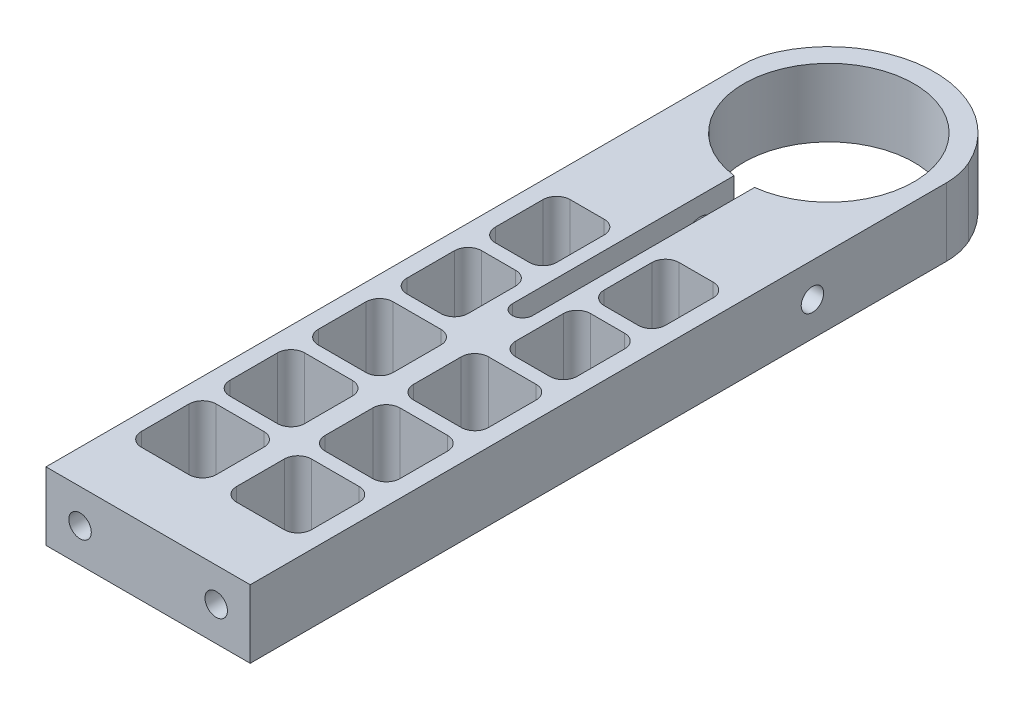
from build123d import *

# Parameters (mm, degrees)
SKETCH_1_R                  = 12.5
EXTRUDE_1_DEPTH             = 10
CUT_EXTRUDE_5_DEPTH         = 102.687019821
SKETCH_8_W                  = 1.65
SKETCH_8_H                  = 14
HOLE_WIZARD_M41_D           = 4.5
HOLE_WIZARD_M41_DEPTH       = 14
HOLE_WIZARD_M41_CBORE_D     = 8
HOLE_WIZARD_M41_CBORE_DEPTH = 4.5
CUT_EXTRUDE_START           = -10
CUT_EXTRUDE_6_DEPTH         = 10
FILLET_1_R                  = 10
M4X0_72_D                   = 3.3
M4X0_72_DEPTH               = 10
M4X0_72_TIP                 = 0.991420021
CUT_EXTRUDE_7_DEPTH         = 102.612007273
EXTRUDE_2_DEPTH             = 10


with BuildPart() as part:
    # Эскиз1 → Бобышка-Вытянуть1 (new body)
    with BuildSketch(Plane(origin=(0, 0, 0), x_dir=(1, 0, 0), z_dir=(0, 1, 0))):
        with BuildLine():
            Line((-15.5, 0), (-15.5, -100))
            Line((-15.5, -100), (15.5, -100))
            Line((15.5, -100), (15.5, 0))
            ThreePointArc((15.5, 0), (0, 15.5), (-15.5, 0))
        make_face()
        with Locations(Location((0, 0, 0), (0, 0, 270))):
            Circle(SKETCH_1_R, mode=Mode.SUBTRACT)
    extrude(amount=EXTRUDE_1_DEPTH)

    # Эскиз6 → Вырез-Вытянуть5 (cut, through all)
    with BuildSketch(Plane(origin=(0, 10, 0), x_dir=(1, 0, 0), z_dir=(0, 1, 0))):
        with BuildLine():
            Line((-1.5, -12.409673646), (-1.5, -26))
            ThreePointArc((-1.5, -26), (0, -27.5), (1.5, -26))
            Line((1.5, -26), (1.5, -12.409673646))
            ThreePointArc((1.5, -12.409673646), (0, -12.5), (-1.5, -12.409673646))
        make_face()
        with BuildLine():
            Line((-1.5, -42.5), (-1.5, -49.5))
            ThreePointArc((-1.5, -49.5), (-2.085786438, -50.914213562), (-3.5, -51.5))
            Line((-3.5, -51.5), (-10.5, -51.5))
            ThreePointArc((-10.5, -51.5), (-11.914213562, -50.914213562), (-12.5, -49.5))
            Line((-12.5, -49.5), (-12.5, -42.5))
            ThreePointArc((-12.5, -42.5), (-11.914213562, -41.085786438), (-10.5, -40.5))
            Line((-10.5, -40.5), (-3.5, -40.5))
            ThreePointArc((-3.5, -40.5), (-2.085786438, -41.085786438), (-1.5, -42.5))
        make_face()
        with BuildLine():
            Line((-1.5, -55.5), (-1.5, -62.5))
            ThreePointArc((-1.5, -62.5), (-2.085786438, -63.914213562), (-3.5, -64.5))
            Line((-3.5, -64.5), (-10.5, -64.5))
            ThreePointArc((-10.5, -64.5), (-11.914213562, -63.914213562), (-12.5, -62.5))
            Line((-12.5, -62.5), (-12.5, -55.5))
            ThreePointArc((-12.5, -55.5), (-11.914213562, -54.085786438), (-10.5, -53.5))
            Line((-10.5, -53.5), (-3.5, -53.5))
            ThreePointArc((-3.5, -53.5), (-2.085786438, -54.085786438), (-1.5, -55.5))
        make_face()
        with BuildLine():
            Line((-1.5, -68.5), (-1.5, -75.5))
            ThreePointArc((-1.5, -75.5), (-2.085786438, -76.914213562), (-3.5, -77.5))
            Line((-3.5, -77.5), (-10.5, -77.5))
            ThreePointArc((-10.5, -77.5), (-11.914213562, -76.914213562), (-12.5, -75.5))
            Line((-12.5, -75.5), (-12.5, -68.5))
            ThreePointArc((-12.5, -68.5), (-11.914213562, -67.085786438), (-10.5, -66.5))
            Line((-10.5, -66.5), (-3.5, -66.5))
            ThreePointArc((-3.5, -66.5), (-2.085786438, -67.085786438), (-1.5, -68.5))
        make_face()
        with BuildLine():
            Line((-1.5, -81.5), (-1.5, -88.5))
            ThreePointArc((-1.5, -88.5), (-2.085786438, -89.914213562), (-3.5, -90.5))
            Line((-3.5, -90.5), (-10.5, -90.5))
            ThreePointArc((-10.5, -90.5), (-11.914213562, -89.914213562), (-12.5, -88.5))
            Line((-12.5, -88.5), (-12.5, -81.5))
            ThreePointArc((-12.5, -81.5), (-11.914213562, -80.085786438), (-10.5, -79.5))
            Line((-10.5, -79.5), (-3.5, -79.5))
            ThreePointArc((-3.5, -79.5), (-2.085786438, -80.085786438), (-1.5, -81.5))
        make_face()
        with BuildLine():
            Line((1.5, -29.5), (1.5, -36.5))
            ThreePointArc((1.5, -36.5), (2.085786438, -37.914213562), (3.5, -38.5))
            Line((3.5, -38.5), (10.5, -38.5))
            ThreePointArc((10.5, -38.5), (11.914213562, -37.914213562), (12.5, -36.5))
            Line((12.5, -36.5), (12.5, -29.5))
            ThreePointArc((12.5, -29.5), (11.914213562, -28.085786438), (10.5, -27.5))
            Line((10.5, -27.5), (3.5, -27.5))
            ThreePointArc((3.5, -27.5), (2.085786438, -28.085786438), (1.5, -29.5))
        make_face()
        with BuildLine():
            Line((-12.5, -29.5), (-12.5, -36.5))
            ThreePointArc((-12.5, -36.5), (-11.914213562, -37.914213562), (-10.5, -38.5))
            Line((-10.5, -38.5), (-3.5, -38.5))
            ThreePointArc((-3.5, -38.5), (-2.085786438, -37.914213562), (-1.5, -36.5))
            Line((-1.5, -36.5), (-1.5, -29.5))
            ThreePointArc((-1.5, -29.5), (-2.085786438, -28.085786438), (-3.5, -27.5))
            Line((-3.5, -27.5), (-10.5, -27.5))
            ThreePointArc((-10.5, -27.5), (-11.914213562, -28.085786438), (-12.5, -29.5))
        make_face()
        with BuildLine():
            Line((10.5, -79.5), (3.5, -79.5))
            ThreePointArc((3.5, -79.5), (2.085786438, -80.085786438), (1.5, -81.5))
            Line((1.5, -81.5), (1.5, -88.5))
            ThreePointArc((1.5, -88.5), (2.085786438, -89.914213562), (3.5, -90.5))
            Line((3.5, -90.5), (10.5, -90.5))
            ThreePointArc((10.5, -90.5), (11.914213562, -89.914213562), (12.5, -88.5))
            Line((12.5, -88.5), (12.5, -81.5))
            ThreePointArc((12.5, -81.5), (11.914213562, -80.085786438), (10.5, -79.5))
        make_face()
        with BuildLine():
            Line((10.5, -66.5), (3.5, -66.5))
            ThreePointArc((3.5, -66.5), (2.085786438, -67.085786438), (1.5, -68.5))
            Line((1.5, -68.5), (1.5, -75.5))
            ThreePointArc((1.5, -75.5), (2.085786438, -76.914213562), (3.5, -77.5))
            Line((3.5, -77.5), (10.5, -77.5))
            ThreePointArc((10.5, -77.5), (11.914213562, -76.914213562), (12.5, -75.5))
            Line((12.5, -75.5), (12.5, -68.5))
            ThreePointArc((12.5, -68.5), (11.914213562, -67.085786438), (10.5, -66.5))
        make_face()
        with BuildLine():
            Line((10.5, -53.5), (3.5, -53.5))
            ThreePointArc((3.5, -53.5), (2.085786438, -54.085786438), (1.5, -55.5))
            Line((1.5, -55.5), (1.5, -62.5))
            ThreePointArc((1.5, -62.5), (2.085786438, -63.914213562), (3.5, -64.5))
            Line((3.5, -64.5), (10.5, -64.5))
            ThreePointArc((10.5, -64.5), (11.914213562, -63.914213562), (12.5, -62.5))
            Line((12.5, -62.5), (12.5, -55.5))
            ThreePointArc((12.5, -55.5), (11.914213562, -54.085786438), (10.5, -53.5))
        make_face()
        with BuildLine():
            Line((10.5, -40.5), (3.5, -40.5))
            ThreePointArc((3.5, -40.5), (2.085786438, -41.085786438), (1.5, -42.5))
            Line((1.5, -42.5), (1.5, -49.5))
            ThreePointArc((1.5, -49.5), (2.085786438, -50.914213562), (3.5, -51.5))
            Line((3.5, -51.5), (10.5, -51.5))
            ThreePointArc((10.5, -51.5), (11.914213562, -50.914213562), (12.5, -49.5))
            Line((12.5, -49.5), (12.5, -42.5))
            ThreePointArc((12.5, -42.5), (11.914213562, -41.085786438), (10.5, -40.5))
        make_face()
    extrude(amount=-CUT_EXTRUDE_5_DEPTH, mode=Mode.SUBTRACT)

    # Эскиз8 → Отверстие обработанное метчиком M4x0.71 (revolve, cut)
    with BuildSketch(Plane(origin=(1.5, 5, 17.409673646), x_dir=(0, 0, 1), z_dir=(0, 1, 0))):
        with Locations((0.825, 7)):
            Rectangle(SKETCH_8_W, SKETCH_8_H)
    revolve(axis=Axis((-4.85, 5, 17.409673646), (1, 0, 0)), mode=Mode.SUBTRACT)

    # Цековка для винта с внутренним шестигранником M41
    with Locations(Plane.ZY.offset(15.5)):
        with Locations((17.409673646, 5)):
            CounterBoreHole(HOLE_WIZARD_M41_D / 2, HOLE_WIZARD_M41_CBORE_D / 2, HOLE_WIZARD_M41_CBORE_DEPTH, depth=HOLE_WIZARD_M41_DEPTH)

    # Эскиз12 → Вырез-Вытянуть6 (cut)
    with BuildSketch(Plane(origin=(0, 10, 0), x_dir=(1, 0, 0), z_dir=(0, 1, 0)).offset(CUT_EXTRUDE_START)):
        with BuildLine():
            Line((-15, 3.905124838), (-15, -100))
            Line((-15, -100), (-15.5, -100))
            Line((-15.5, -100), (-15.5, 0))
            ThreePointArc((-15.5, 0), (-15.374491862, 1.968501969), (-15, 3.905124838))
        make_face()
        with BuildLine():
            Line((15, -100), (15, 3.905124838))
            ThreePointArc((15, 3.905124838), (15.374491862, 1.968501969), (15.5, 0))
            Line((15.5, 0), (15.5, -100))
            Line((15.5, -100), (15, -100))
        make_face()
    extrude(amount=CUT_EXTRUDE_6_DEPTH, mode=Mode.SUBTRACT)

    # Скругление1
    fillet_1_edges = [part.edges().sort_by_distance(p)[0] for p in [
        (15, 5, -3.905124838),
        (-15, 5, -3.905124838),
    ]]
    fillet(fillet_1_edges, radius=FILLET_1_R)

    # Отверстие обработанное метчиком M4x0.72
    with Locations(Plane.XY.offset(100)):
        with Locations((-9.998288453, 5), (10.001711547, 5)):
            Hole(M4X0_72_D / 2, depth=M4X0_72_DEPTH)
            with Locations((0, 0, -(M4X0_72_DEPTH + M4X0_72_TIP / 2))):  # 118° drill point
                Cone(0, M4X0_72_D / 2, M4X0_72_TIP, mode=Mode.SUBTRACT)

    # Эскиз16 → Вырез-Вытянуть7 (cut, through all)
    with BuildSketch(Plane(origin=(0, 10, 0), x_dir=(1, 0, 0), z_dir=(0, 1, 0))):
        with BuildLine():
            Line((1.5, -26), (1.5, -45))
            ThreePointArc((1.5, -45), (0, -46.5), (-1.5, -45))
            Line((-1.5, -45), (-1.5, -26))
            ThreePointArc((-1.5, -26), (0, -24.5), (1.5, -26))
        make_face()
    extrude(amount=-CUT_EXTRUDE_7_DEPTH, mode=Mode.SUBTRACT)

    # Эскиз17 → Бобышка-Вытянуть2 (add, through all)
    with BuildSketch(Plane(origin=(0, 10, 0), x_dir=(1, 0, 0), z_dir=(0, 1, 0))):
        with BuildLine():
            Line((-1.5, -29.5), (-1.5, -36.5))
            ThreePointArc((-1.5, -36.5), (-2.085786438, -37.914213562), (-3.5, -38.5))
            Line((-3.5, -38.5), (-5.5, -38.5))
            ThreePointArc((-5.5, -38.5), (-4.085786438, -37.914213562), (-3.5, -36.5))
            Line((-3.5, -36.5), (-3.5, -29.5))
            ThreePointArc((-3.5, -29.5), (-4.085786438, -28.085786438), (-5.5, -27.5))
            Line((-5.5, -27.5), (-3.5, -27.5))
            ThreePointArc((-3.5, -27.5), (-2.085786438, -28.085786438), (-1.5, -29.5))
        make_face()
        with BuildLine():
            Line((-1.5, -42.5), (-1.5, -49.5))
            ThreePointArc((-1.5, -49.5), (-2.085786438, -50.914213562), (-3.5, -51.5))
            Line((-3.5, -51.5), (-5.5, -51.5))
            ThreePointArc((-5.5, -51.5), (-4.085786438, -50.914213562), (-3.5, -49.5))
            Line((-3.5, -49.5), (-3.5, -42.5))
            ThreePointArc((-3.5, -42.5), (-4.085786438, -41.085786438), (-5.5, -40.5))
            Line((-5.5, -40.5), (-3.5, -40.5))
            ThreePointArc((-3.5, -40.5), (-2.085786438, -41.085786438), (-1.5, -42.5))
        make_face()
        with BuildLine():
            Line((5.5, -51.5), (3.5, -51.5))
            ThreePointArc((3.5, -51.5), (2.085786438, -50.914213562), (1.5, -49.5))
            Line((1.5, -49.5), (1.5, -42.5))
            ThreePointArc((1.5, -42.5), (2.085786438, -41.085786438), (3.5, -40.5))
            Line((3.5, -40.5), (5.5, -40.5))
            ThreePointArc((5.5, -40.5), (4.085786438, -41.085786438), (3.5, -42.5))
            Line((3.5, -42.5), (3.5, -49.5))
            ThreePointArc((3.5, -49.5), (4.085786438, -50.914213562), (5.5, -51.5))
        make_face()
        with BuildLine():
            Line((5.5, -38.5), (3.5, -38.5))
            ThreePointArc((3.5, -38.5), (2.085786438, -37.914213562), (1.5, -36.5))
            Line((1.5, -36.5), (1.5, -29.5))
            ThreePointArc((1.5, -29.5), (2.085786438, -28.085786438), (3.5, -27.5))
            Line((3.5, -27.5), (5.5, -27.5))
            ThreePointArc((5.5, -27.5), (4.085786438, -28.085786438), (3.5, -29.5))
            Line((3.5, -29.5), (3.5, -36.5))
            ThreePointArc((3.5, -36.5), (4.085786438, -37.914213562), (5.5, -38.5))
        make_face()
    extrude(amount=-EXTRUDE_2_DEPTH)


solid = part.part
